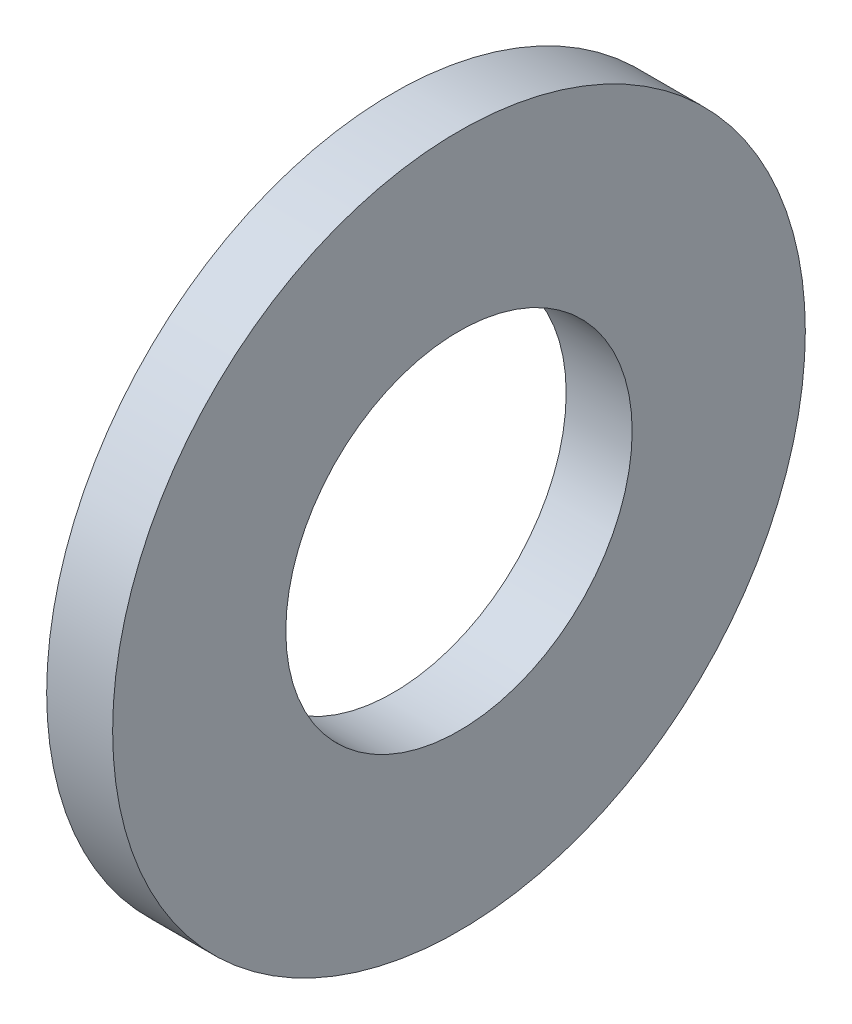
from build123d import *

# Parameters (mm, degrees)
SKETCH1_W = 2
SKETCH1_H = 5.25


with BuildPart() as part:
    # Sketch1 → Revolve1 (revolve)
    with BuildSketch(Plane.XY, mode=Mode.PRIVATE) as revolve1_sk:
        with Locations((1, 7.875)):
            Rectangle(SKETCH1_W, SKETCH1_H)
    revolve(revolve1_sk.sketch.rotate(Axis((4.046168167, 0, 0), (-1, 0, 0)), 270), axis=Axis((4.046168167, 0, 0), (-1, 0, 0)))


solid = part.part
